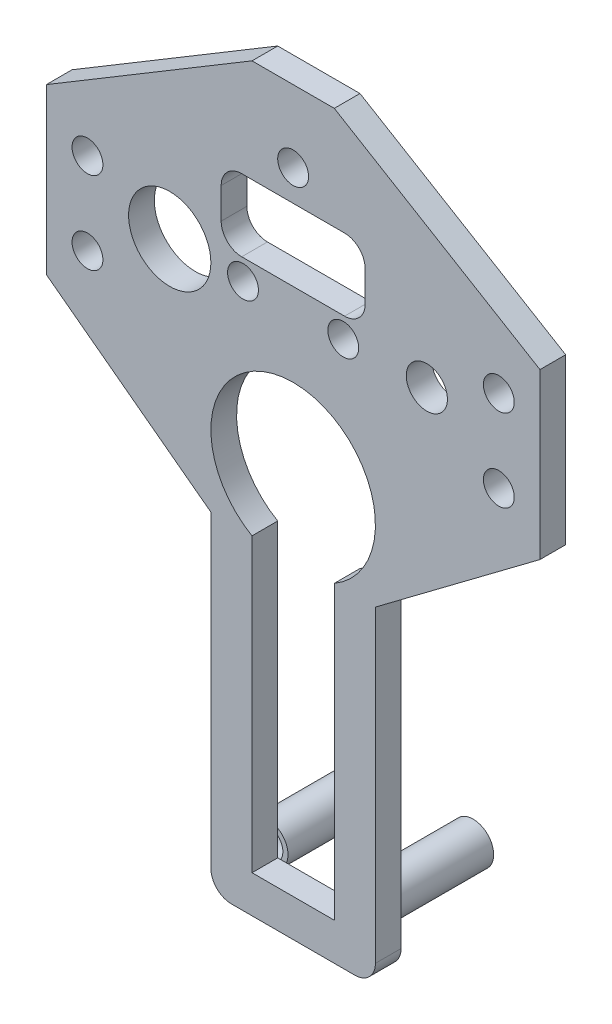
from build123d import *

# Parameters (mm, degrees)
SKETCH1_R           = 4
SKETCH1_R_2         = 1.5
SKETCH1_R_3         = 2
BOSS_EXTRUDE1_DEPTH = 2.5
SKETCH2_R           = 2
SKETCH2_R_2         = 1.5
BOSS_EXTRUDE2_DEPTH = 10
FILLET1_R           = 2


with BuildPart() as part:
    # Sketch1 → Boss-Extrude1 (new body)
    with BuildSketch(Plane.XY):
        Polygon((-24, 5.07179677), (-24, 21.07179677), (-4, 33.07179677), (4, 33.07179677), (24, 21.07179677), (24, 5.07179677), (8, -6.92820323), (8, -38.92820323), (-8, -38.92820323), (-8, -6.92820323), align=None)
        with Locations((-12, 14.07179677)):
            Circle(SKETCH1_R, mode=Mode.SUBTRACT)
        with Locations((-4.875, 14.07179677)):
            Circle(SKETCH1_R_2, mode=Mode.SUBTRACT)
        with Locations((4.875, 14.07179677)):
            Circle(SKETCH1_R_2, mode=Mode.SUBTRACT)
        with Locations((0, 26.07179677)):
            Circle(SKETCH1_R_2, mode=Mode.SUBTRACT)
        with Locations((20, 17.07179677)):
            Circle(SKETCH1_R_2, mode=Mode.SUBTRACT)
        with Locations((20, 9.07179677)):
            Circle(SKETCH1_R_2, mode=Mode.SUBTRACT)
        with Locations((-20, 17.07179677)):
            Circle(SKETCH1_R_2, mode=Mode.SUBTRACT)
        with Locations((-20, 9.07179677)):
            Circle(SKETCH1_R_2, mode=Mode.SUBTRACT)
        with Locations((13, 14.07179677)):
            Circle(SKETCH1_R_3, mode=Mode.SUBTRACT)
        with BuildLine():
            Line((-4, -35.29820323), (4, -35.29820323))
            Line((4, -35.29820323), (4, -6.92820323))
            ThreePointArc((4, -6.92820323), (0, 8), (-4, -6.92820323))
            Line((-4, -6.92820323), (-4, -35.29820323))
        make_face(mode=Mode.SUBTRACT)
        with BuildLine():
            Line((-5, 23.07179677), (5, 23.07179677))
            ThreePointArc((5, 23.07179677), (6.414213562, 22.486010332), (7, 21.07179677))
            Line((7, 21.07179677), (7, 18.07179677))
            ThreePointArc((7, 18.07179677), (6.414213562, 16.657583207), (5, 16.07179677))
            Line((5, 16.07179677), (-5, 16.07179677))
            ThreePointArc((-5, 16.07179677), (-6.414213562, 16.657583207), (-7, 18.07179677))
            Line((-7, 18.07179677), (-7, 21.07179677))
            ThreePointArc((-7, 21.07179677), (-6.414213562, 22.486010332), (-5, 23.07179677))
        make_face(mode=Mode.SUBTRACT)
    extrude(amount=BOSS_EXTRUDE1_DEPTH)

    # Sketch2 → Boss-Extrude2 (add)
    # profile 1 of 2: a face of its own
    with BuildSketch(Plane(origin=(0, 0, 0), x_dir=(-1, 0, 0), z_dir=(0, 0, -1))):
        with Locations(Location((-5, -34.53164975, 0), (0, 0, 60))):
            Circle(SKETCH2_R)
        with Locations(Location((-5, -34.53164975, 0), (0, 0, 48.189685104))):
            Circle(SKETCH2_R_2, mode=Mode.SUBTRACT)
    # profile 2 of 2: a face of its own
    with BuildSketch(Plane(origin=(0, 0, 0), x_dir=(-1, 0, 0), z_dir=(0, 0, -1))):
        with Locations(Location((5, -34.53164975, 0), (0, 0, 180))):
            Circle(SKETCH2_R)
        with Locations(Location((5, -34.53164975, 0), (0, 0, 180))):
            Circle(SKETCH2_R_2, mode=Mode.SUBTRACT)
    extrude(amount=BOSS_EXTRUDE2_DEPTH)

    # Fillet1
    fillet1_edges = [part.edges().sort_by_distance(p)[0] for p in [
        (8, -38.92820323, 1.25),
        (-8, -38.92820323, 1.25),
    ]]
    fillet(fillet1_edges, radius=FILLET1_R)


solid = part.part
